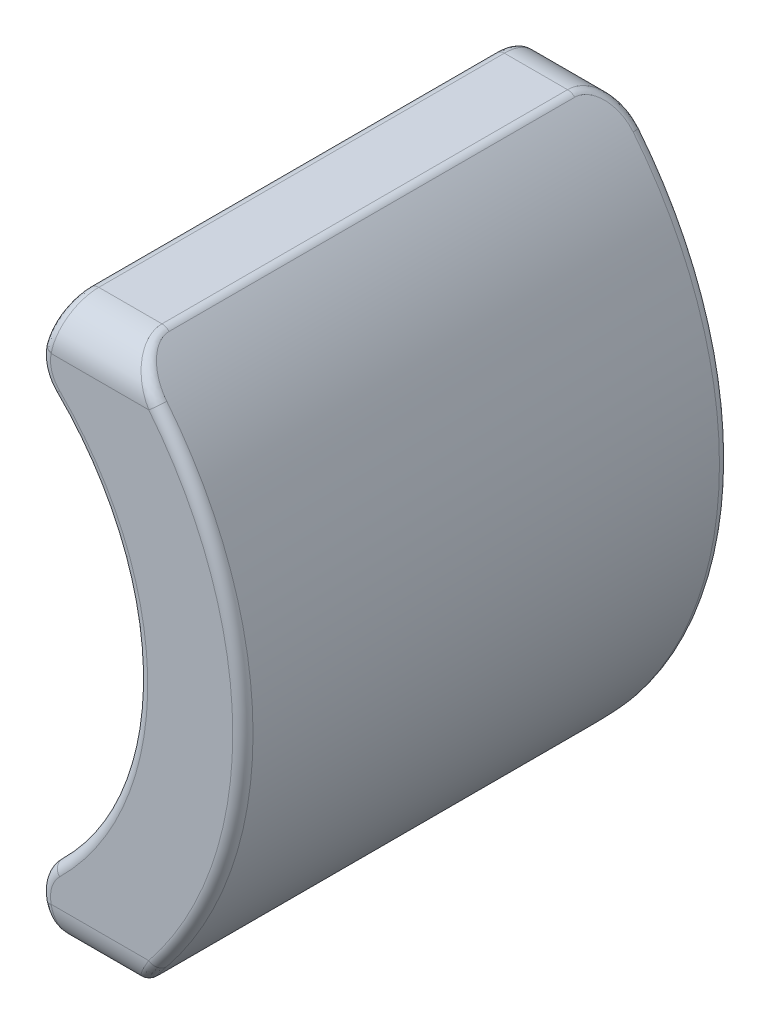
from build123d import *

# Parameters (mm, degrees)
BOSS_EXTRUDE1_DEPTH = 12
FILLET1_R           = 1
FILLET2_R           = 1
FILLET3_R           = 0.25


with BuildPart() as part:
    # Sketch1 → Boss-Extrude1 (new body)
    with BuildSketch(Plane.XY):
        with BuildLine():
            Line((6.738137725, -6.88), (4.878137725, -6.88))
            Line((4.878137725, -6.88), (4.531835438, -5.38))
            ThreePointArc((4.531835438, -5.38), (7.034339517, 0), (4.531835438, 5.38))
            Line((4.531835438, 5.38), (4.878137725, 6.88))
            Line((4.878137725, 6.88), (6.738137725, 6.88))
            ThreePointArc((6.738137725, 6.88), (9.63, 0), (6.738137725, -6.88))
        make_face()
    extrude(amount=BOSS_EXTRUDE1_DEPTH)

    # Fillet1
    fillet1_edges = [part.edges().sort_by_distance(p)[0] for p in [
        (4.531835438, -5.38, 6),
        (4.531835438, 5.38, 6),
    ]]
    fillet(fillet1_edges, radius=FILLET1_R)

    # Fillet2
    fillet2_edges = [part.edges().sort_by_distance(p)[0] for p in [
        (5.808137725, -6.88, 12),
        (5.808137725, -6.88, 0),
        (5.808137725, 6.88, 12),
        (5.808137725, 6.88, 0),
    ]]
    fillet(fillet2_edges, radius=FILLET2_R)

    # Fillet3
    fillet3_edges = [part.edges().sort_by_distance(p)[0] for p in [
        (7.034339517, 0, 0),
        (4.687877266, 5.411310183, 0),
        (7.034339517, 0, 12),
        (4.687877266, -5.411310183, 12),
        (9.63, 0, 12),
        (4.687877266, 5.411310183, 12),
        (9.63, 0, 0),
        (6.738137725, 6.88, 6),
        (6.738137725, -6.88, 6),
        (7.064336577, 6.544619807, 0.2528183),
        (7.064336577, 6.544619807, 11.7471817),
        (7.064336577, -6.544619807, 0.2528183),
        (7.064336589, -6.544619821, 11.747181705),
        (4.878137725, -6.88, 6),
        (4.815123489, -6.607055355, 0.313421155),
        (4.815123489, -6.607055355, 11.686578845),
        (4.687877266, -5.411310183, 0),
        (4.655934772, -5.914769545, 0.000604643),
        (4.655934772, -5.914769545, 11.999395357),
        (4.655934776, 5.914769544, 0.00060465),
        (4.655934776, 5.914769544, 11.99939535),
        (4.878137725, 6.88, 6),
        (4.815123489, 6.607055355, 0.313421155),
        (4.815123489, 6.607055355, 11.686578845),
    ]]
    fillet(fillet3_edges, radius=FILLET3_R)


solid = part.part
